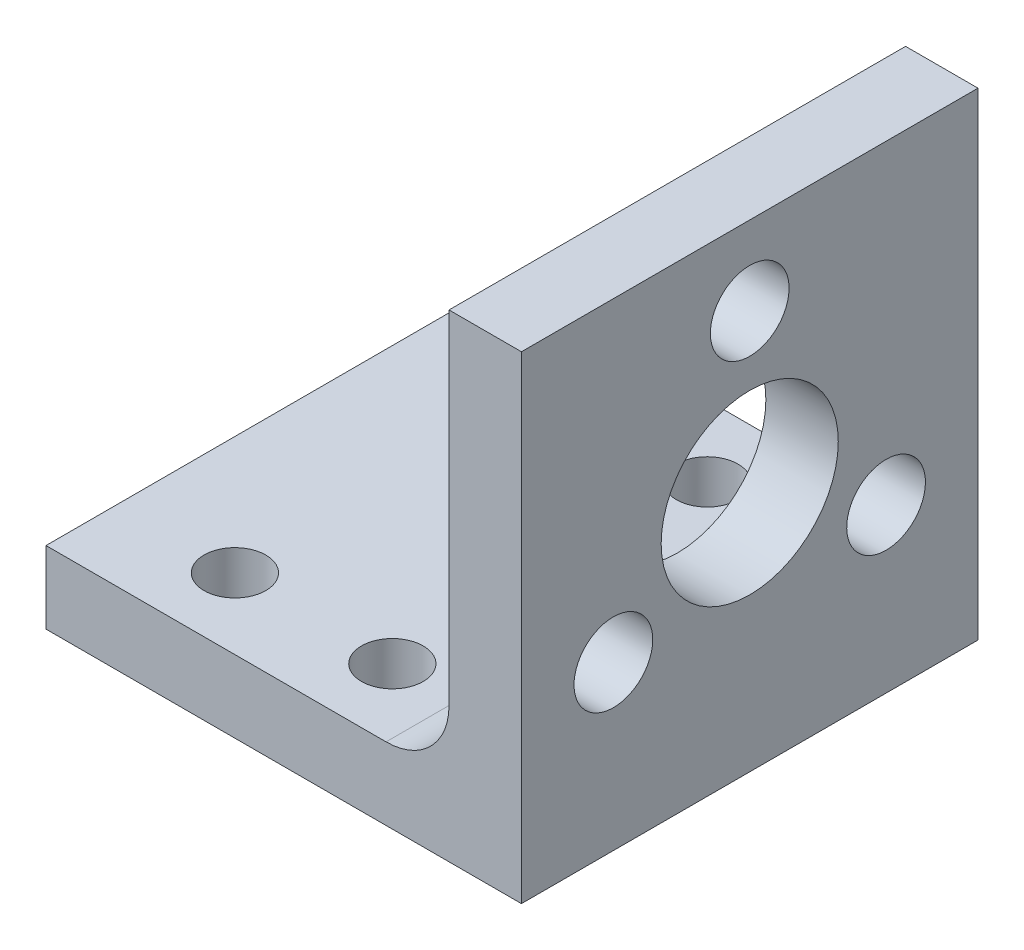
from build123d import *

# Parameters (mm, degrees)
BOSS_EXTRUDE1_DEPTH = 36.83
SKETCH2_R           = 7.14375
SKETCH2_R_2         = 3.175
CUT_EXTRUDE1_DEPTH  = 66.682081939
SKETCH3_R           = 2.4892
CUT_EXTRUDE2_DEPTH  = 66.682081995


with BuildPart() as part:
    # Sketch1 → Boss-Extrude1 (new body)
    with BuildSketch(Plane.XY):
        with BuildLine():
            Line((0, 38.5572), (0, 0))
            Line((0, 0), (-38.354, 0))
            Line((-38.354, 0), (-38.354, 5.842))
            Line((-38.354, 5.842), (-10.922, 5.842))
            ThreePointArc((-10.922, 5.842), (-7.329897552, 7.329897552), (-5.842, 10.922))
            Line((-5.842, 10.922), (-5.842, 38.5572))
            Line((-5.842, 38.5572), (0, 38.5572))
        make_face()
    extrude(amount=BOSS_EXTRUDE1_DEPTH)

    # Sketch2 → Cut-Extrude1 (cut, through all)
    with BuildSketch(Plane(origin=(0, 0, 0), x_dir=(0, 0, -1), z_dir=(1, 0, 0))):
        with Locations(Location((-18.415, 19.5072, 0), (0, 0, 90))):
            Circle(SKETCH2_R)
        with Locations(Location((-18.415, 32.2072, 0), (0, 0, 90))):
            Circle(SKETCH2_R_2)
        with Locations(Location((-7.416477372, 13.1572, 0), (0, 0, 90))):
            Circle(SKETCH2_R_2)
        with Locations(Location((-29.413522628, 13.1572, 0), (0, 0, 90))):
            Circle(SKETCH2_R_2)
    extrude(amount=-CUT_EXTRUDE1_DEPTH, mode=Mode.SUBTRACT)

    # Sketch3 → Cut-Extrude2 (cut, through all)
    with BuildSketch(Plane.XZ):
        with Locations((-28.829, 31.115)):
            Circle(SKETCH3_R)
        with Locations((-16.129, 31.115)):
            Circle(SKETCH3_R)
        with Locations((-16.129, 5.715)):
            Circle(SKETCH3_R)
        with Locations((-28.829, 5.715)):
            Circle(SKETCH3_R)
    extrude(amount=-CUT_EXTRUDE2_DEPTH, mode=Mode.SUBTRACT)


solid = part.part
